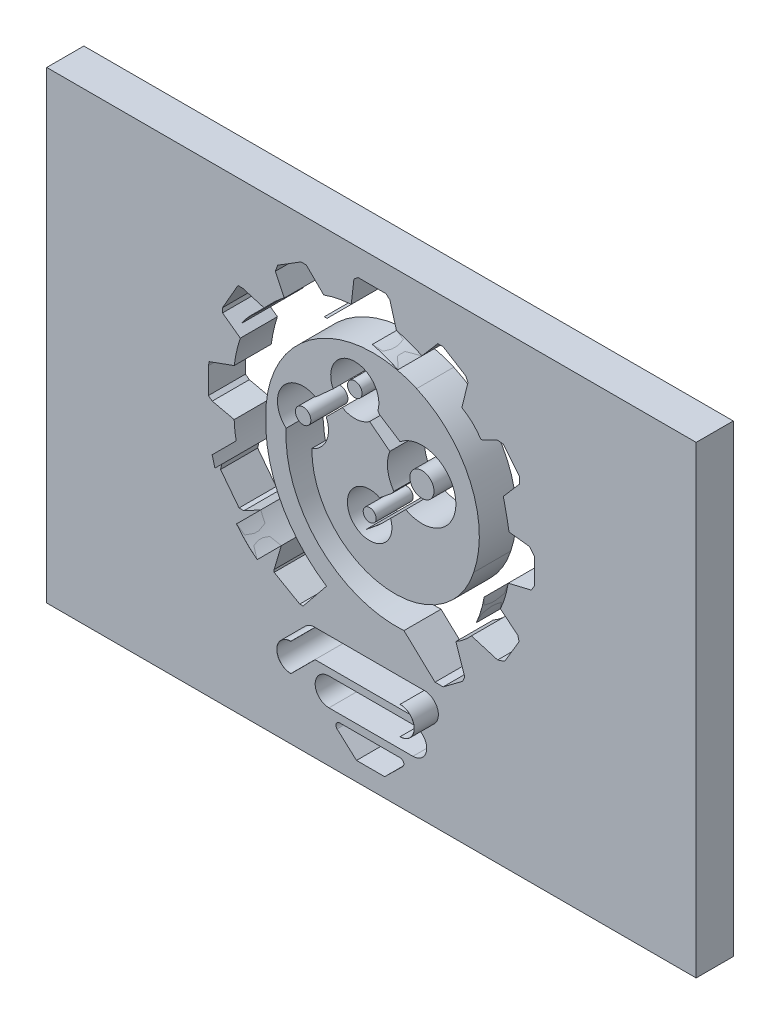
from build123d import *

# Parameters (mm, degrees)
BOSS_EXTRUDE1_DEPTH   = 10
BOSS_EXTRUDE1_2_DEPTH = 10
BOSS_EXTRUDE1_3_DEPTH = 10
SKETCH1_R             = 1.735714146
SKETCH1_R_2           = 3.25388296
SKETCH1_R_3           = 1.963199763
SKETCH1_R_4           = 2.077188844
BOSS_EXTRUDE1_4_DEPTH = 10
CUT_EXTRUDE2_DEPTH    = 3.5
SKETCH3_W             = 175
SKETCH3_H             = 125
BOSS_EXTRUDE2_DEPTH   = 10
CUT_EXTRUDE3_START    = -56
SKETCH4_R             = 2.077188844
SKETCH4_R_2           = 1.963199763
SKETCH4_R_3           = 3.25388296
SKETCH4_R_4           = 1.735714146
CUT_EXTRUDE3_DEPTH    = 56
SKETCH5_W             = 29.451232435
SKETCH5_H             = 6.5
CUT_EXTRUDE4_DEPTH    = 50


with BuildPart() as part:
    # Sketch1 → Boss-Extrude1 (new body)
    with BuildSketch(Plane.XY):
        with BuildLine():
            Line((36.612676513, 50.128115897), (66.063908948, 50.128115897))
            ThreePointArc((66.063908948, 50.128115897), (69.85606523, 46.335959615), (66.063908948, 42.543803333))
            Line((66.063908948, 42.543803333), (36.612676513, 42.543803333))
            ThreePointArc((36.612676513, 42.543803333), (32.82052023, 46.335959615), (36.612676513, 50.128115897))
        make_face()
    extrude(amount=BOSS_EXTRUDE1_DEPTH)



with BuildPart() as body_2:
    # Sketch1 → Boss-Extrude1 2 (new body)
    with BuildSketch(Plane.XY):
        with BuildLine():
            Line((40.371121954, 40.631857622), (62.992183574, 40.631857622))
            ThreePointArc((62.992183574, 40.631857622), (66.703998638, 36.920042558), (62.992183574, 33.208227494))
            Line((62.992183574, 33.208227494), (40.371121954, 33.208227494))
            ThreePointArc((40.371121954, 33.208227494), (36.65930689, 36.920042558), (40.371121954, 40.631857622))
        make_face()
    extrude(amount=BOSS_EXTRUDE1_2_DEPTH)


with BuildPart() as body_3:
    # Sketch1 → Boss-Extrude1 3 (new body)
    with BuildSketch(Plane.XY):
        with BuildLine():
            Line((43.291590681, 31.145459419), (59.548762461, 31.145459419))
            ThreePointArc((59.548762461, 31.145459419), (60.47915555, 30.526270831), (60.255275906, 29.431326214))
            Line((60.255275906, 29.431326214), (55.380256876, 24.642590707))
            Line((55.380256876, 24.642590707), (47.793576713, 24.642590707))
            Line((47.793576713, 24.642590707), (42.554783621, 29.366497269))
            ThreePointArc((42.554783621, 29.366497269), (42.328835394, 30.502145791), (43.291590681, 31.145459419))
        make_face()
    extrude(amount=BOSS_EXTRUDE1_3_DEPTH)


with BuildPart() as body_4:
    # Sketch1 → Boss-Extrude1 4 (new body)
    with BuildSketch(Plane.XY):
        with BuildLine():
            Line((54.042424699, 89.057178574), (57.338263311, 91.74525403))
            Line((57.338263311, 91.74525403), (57.858109934, 92.482001406))
            ThreePointArc((57.858109934, 92.482001406), (56.203750586, 96.735543385), (56.775287603, 101.263552843))
            Line((56.775287603, 101.263552843), (51.33821868, 105.502853511))
            ThreePointArc((51.33821868, 105.502853511), (47.717753365, 104.214223221), (43.975219744, 105.087022863))
            Line((43.975219744, 105.087022863), (39.619407743, 100.731210862))
            ThreePointArc((39.619407743, 100.731210862), (39.726080925, 95.257490785), (35.780591664, 91.461953256))
            ThreePointArc((35.780591664, 91.461953256), (54.470931261, 69.004961782), (79.367543752, 84.29561078))
            ThreePointArc((79.367543752, 84.29561078), (78.518157241, 104.885379157), (63.999024785, 119.509154728))
            ThreePointArc((63.999024785, 119.509154728), (36.348842887, 117.238880972), (23.350287639, 92.729204038))
            ThreePointArc((23.350287639, 92.729204038), (27.391085677, 74.838212259), (39.726172291, 61.263925027))
            Line((39.726172291, 61.263925027), (33.41222021, 53.484864806))
            Line((33.41222021, 53.484864806), (32.501801001, 53.484864806))
            Line((32.501801001, 53.484864806), (25.600419414, 57.431311375))
            Line((25.600419414, 57.431311375), (25.600419414, 58.091089656))
            Line((25.600419414, 58.091089656), (27.529461306, 64.624845993))
            add(Edge.make_bspline(
                [(27.529461306, 64.624845993), (24.51350433, 66.863878585), (21.96798092, 70.186326379)],
                knots=[0, 0, 0, 1, 1, 1], degree=2))
            Line((21.96798092, 70.186326379), (17.44826512, 67.73638598))
            Line((17.44826512, 67.73638598), (16.147653792, 67.73638598))
            Line((16.147653792, 67.73638598), (11.164001938, 74.227807572))
            Line((11.164001938, 74.227807572), (11.478280842, 75.608236048))
            Line((11.478280842, 75.608236048), (16.147653792, 80.277608998))
            add(Edge.make_bspline(
                [(14.836422664, 87.711108712), (14.969965726, 83.721585295), (16.147653792, 80.277608998)],
                knots=[0, 0, 0, 1, 1, 1], degree=2))
            Line((14.836422664, 87.711108712), (8.923989025, 89.057178574))
            Line((8.923989025, 89.057178574), (7.872310913, 89.823022551))
            Line((7.872310913, 89.823022551), (7.872310913, 96.783792065))
            Line((7.872310913, 96.783792065), (8.120139021, 97.872344214))
            Line((8.120139021, 97.872344214), (14.836422664, 100.309725684))
            ThreePointArc((14.836422664, 100.309725684), (15.482642582, 103.966872263), (16.483280209, 107.543329397))
            Line((16.483280209, 107.543329397), (11.70192116, 111.025169506))
            Line((11.70192116, 111.025169506), (11.70192116, 112.254374343))
            Line((11.70192116, 112.254374343), (15.850453276, 119.509154728))
            Line((15.850453276, 119.509154728), (17.116107143, 119.509154728))
            Line((17.116107143, 119.509154728), (23.350287639, 117.668560326))
            add(Edge.make_bspline(
                [(28.34341676, 122.838084344), (25.083188206, 120.541403415), (23.350287639, 117.668560326)],
                knots=[0, 0, 0, 1, 1, 1], degree=2))
            Line((28.34341676, 122.838084344), (25.924430047, 127.860583288))
            Line((25.924430047, 127.860583288), (26.55905403, 129.601522707))
            Line((26.55905403, 129.601522707), (32.835382419, 133.499504209))
            Line((32.835382419, 133.499504209), (34.268559767, 133.499504209))
            Line((34.268559767, 133.499504209), (38.960915607, 128.841575946))
            add(Edge.make_bspline(
                [(46.383652832, 130.361469468), (43.207748731, 130.193389879), (38.960915607, 128.841575946)],
                knots=[0, 0, 0, 1, 1, 1], degree=2))
            Line((46.383652832, 130.361469468), (47.099801145, 136.637538949))
            Line((47.099801145, 136.637538949), (48.204973985, 137.54371488))
            Line((48.204973985, 137.54371488), (55.716804255, 137.54371488))
            Line((55.716804255, 137.54371488), (56.775287603, 136.637538949))
            Line((56.775287603, 136.637538949), (58.560830407, 130.361469468))
            add(Edge.make_bspline(
                [(65.42141471, 127.860583288), (62.762273281, 129.346820645), (58.560830407, 130.361469468)],
                knots=[0, 0, 0, 1, 1, 1], degree=2))
            Line((65.42141471, 127.860583288), (69.703471426, 132.862355649))
            Line((69.703471426, 132.862355649), (71.141353612, 132.862355649))
            Line((71.141353612, 132.862355649), (77.253367018, 129.076282377))
            Line((77.253367018, 129.076282377), (77.838884302, 127.860583288))
            Line((77.838884302, 127.860583288), (76.183025885, 121.169766859))
            add(Edge.make_bspline(
                [(76.183025885, 121.169766859), (79.253811261, 119.413315061), (81.326289538, 116.311143396)],
                knots=[0, 0, 0, 1, 1, 1], degree=2))
            Line((81.326289538, 116.311143396), (81.695672628, 116.410742944))
            Line((81.695672628, 116.410742944), (85.815355288, 118.394906151))
            Line((85.815355288, 118.394906151), (87.360330483, 118.218612472))
            Line((87.360330483, 118.218612472), (91.659132082, 112.975790841))
            Line((91.659132082, 112.975790841), (91.659132082, 111.025169506))
            Line((91.659132082, 111.025169506), (87.360330483, 106.045624317))
            Line((87.360330483, 106.045624317), (88.905274365, 98.500548104))
            Line((88.905274365, 98.500548104), (94.4129898, 97.87207496))
            Line((94.4129898, 97.87207496), (95.767055319, 96.21186062))
            Line((95.767055319, 96.21186062), (95.767055319, 89.382694603))
            Line((95.767055319, 89.382694603), (94.909859849, 87.946746758))
            Line((94.909859849, 87.946746758), (88.683296287, 86.458456895))
            add(Edge.make_bspline(
                [(88.683296287, 86.458456895), (88.100618882, 82.748375774), (86.564981896, 79.397644229)],
                knots=[0, 0, 0, 1, 1, 1], degree=2))
            Line((86.564981896, 79.397644229), (91.245566834, 75.624301928))
            Line((91.245566834, 75.624301928), (91.598019479, 74.227807572))
            Line((91.598019479, 74.227807572), (87.722936412, 67.73638598))
            Line((87.722936412, 67.73638598), (85.815355288, 67.093511057))
            Line((85.815355288, 67.093511057), (78.775745724, 69.205464306))
            add(Edge.make_bspline(
                [(78.775745724, 69.205464306), (76.888993362, 67.188035301), (74.572909919, 65.777644834)],
                knots=[0, 0, 0, 1, 1, 1], degree=2))
            Line((74.572909919, 65.777644834), (76.954362748, 58.711239992))
            Line((76.954362748, 58.711239992), (76.421059157, 57.431311375))
            Line((76.421059157, 57.431311375), (71.141353612, 53.484864806))
            Line((71.141353612, 53.484864806), (68.954808891, 53.484864806))
            Line((68.954808891, 53.484864806), (60.578889007, 61.332051704))
            ThreePointArc((60.578889007, 61.332051704), (37.638360698, 69.85475845), (28.834470871, 92.688853424))
            ThreePointArc((28.834470871, 92.688853424), (27.758447656, 101.854708046), (36.751263907, 103.928345615))
            Line((36.751263907, 103.928345615), (41.493079417, 108.204751423))
            ThreePointArc((41.493079417, 108.204751423), (46.823385651, 117.490522776), (53.542937831, 109.154736511))
            Line((53.542937831, 109.154736511), (54.042232948, 108.423261616))
            Line((54.042232948, 108.423261616), (59.548581239, 104.89051106))
            ThreePointArc((59.548581239, 104.89051106), (74.526662809, 98.789825799), (61.067178135, 89.823022551))
            Line((61.067178135, 89.823022551), (60.090678716, 88.942366655))
            Line((60.090678716, 88.942366655), (56.775372182, 86.238413225))
            ThreePointArc((56.775372182, 86.238413225), (47.03062353, 79.524599219), (54.042424699, 89.057178574))
        make_face()
        with Locations((51.33830326, 83.70113079)):
            Circle(SKETCH1_R, mode=Mode.SUBTRACT)
        with Locations((65.42141471, 97.872141243)):
            Circle(SKETCH1_R_2, mode=Mode.SUBTRACT)
        with Locations((47.333100287, 111.025169506)):
            Circle(SKETCH1_R_3, mode=Mode.SUBTRACT)
        with Locations((33.41222021, 97.872344214)):
            Circle(SKETCH1_R_4, mode=Mode.SUBTRACT)
    extrude(amount=BOSS_EXTRUDE1_4_DEPTH)

    # Sketch2 → Cut-Extrude2 (cut)
    with BuildSketch(Plane(origin=(0, 0, 0), x_dir=(-1, 0, 0), z_dir=(0, 0, -1))):
        with BuildLine():
            Line((-36.882576832, 101.353568923), (-42.290231098, 106.230461342))
            Line((-42.290231098, 106.230461342), (-37.080357203, 101.020587447))
            ThreePointArc((-37.080357203, 101.020587447), (-37.893710893, 96.06046516), (-33.861615538, 93.059371298))
            ThreePointArc((-33.861615538, 93.059371298), (-53.367472026, 67.172595862), (-81.267551741, 83.670751264))
            ThreePointArc((-81.267551741, 83.670751264), (-80.346652287, 105.695765365), (-64.812170652, 121.336391385))
            ThreePointArc((-64.812170652, 121.336391385), (-35.268906863, 118.922417224), (-21.349861224, 92.751978269))
            ThreePointArc((-21.349861224, 92.751978269), (-25.129717063, 74.884715442), (-36.81226348, 60.847461425))
            Line((-36.81226348, 60.847461425), (-32.641490793, 55.708890291))
            Line((-32.641490793, 55.708890291), (-27.799852639, 58.477504958))
            Line((-27.799852639, 58.477504958), (-29.856074316, 65.442025158))
            add(Edge.make_bspline(
                [(-29.856074316, 65.442025158), (-29.175521421, 65.883970458), (-27.879064513, 66.83183634), (-26.00235788, 68.531221621), (-24.519885547, 70.169582429), (-23.383769421, 71.61199016), (-22.824457002, 72.38961669), (-22.555784216, 72.779877494)],
                knots=[0.500282491, 0.500282491, 0.500282491, 0.500282491, 0.500474616, 0.500666741, 0.500858866, 0.500954928, 0.501050991, 0.501050991, 0.501050991, 0.501050991], degree=3))
            Line((-22.555784216, 72.779877494), (-17.0770441, 69.810091883))
            Line((-17.0770441, 69.810091883), (-13.355732604, 74.657260685))
            Line((-13.355732604, 74.657260685), (-18.472416218, 79.773944264))
            add(Edge.make_bspline(
                [(-18.472416218, 79.773944264), (-18.180879786, 80.48416116), (-17.682088455, 81.925076377), (-17.152529334, 84.237432109), (-16.903073855, 86.281021736), (-16.819114201, 87.983569854), (-16.816446117, 88.87065466), (-16.824762225, 89.309605882)],
                knots=[0.500152836, 0.500152836, 0.500152836, 0.500152836, 0.500341207, 0.500529579, 0.500717951, 0.500812137, 0.500906323, 0.500906323, 0.500906323, 0.500906323], degree=3))
            Line((-16.824762225, 89.309605882), (-9.872310913, 90.892454127))
            Line((-9.872310913, 90.892454127), (-9.872310913, 96.380589694))
            Line((-9.872310913, 96.380589694), (-16.688696078, 98.854298633))
            ThreePointArc((-16.688696078, 98.854298633), (-17.459873001, 103.641146011), (-18.868263889, 108.280656412))
            Line((-18.868263889, 108.280656412), (-13.83108217, 111.948789503))
            Line((-13.83108217, 111.948789503), (-16.984161581, 117.462763608))
            Line((-16.984161581, 117.462763608), (-24.362840661, 115.284264699))
            add(Edge.make_bspline(
                [(-24.362840661, 115.284264699), (-24.646652824, 115.933709084), (-25.322213081, 117.159331227), (-26.734958109, 118.921539462), (-28.263474131, 120.307897606), (-29.694417524, 121.359457035), (-30.504172759, 121.879036013), (-30.908098275, 122.122180546)],
                knots=[0.500066259, 0.500066259, 0.500066259, 0.500066259, 0.50030451, 0.500542761, 0.500781012, 0.500900138, 0.501019263, 0.501019263, 0.501019263, 0.501019263], degree=3))
            Line((-30.908098275, 122.122180546), (-28.092433001, 127.968296092))
            Line((-28.092433001, 127.968296092), (-28.20138546, 128.267181157))
            Line((-28.20138546, 128.267181157), (-33.405905009, 131.499504209))
            Line((-33.405905009, 131.499504209), (-33.444443051, 131.499504209))
            Line((-33.444443051, 131.499504209), (-38.424034638, 126.556447474))
            add(Edge.make_bspline(
                [(-38.424034638, 126.556447474), (-38.923711949, 126.728684385), (-39.951259542, 127.065423843), (-41.843524077, 127.61415179), (-44.028521179, 128.110611382), (-45.919655934, 128.349957825), (-47.272276607, 128.396300717), (-47.862527424, 128.375584423), (-48.167409158, 128.352648043)],
                knots=[0.498388849, 0.498388849, 0.498388849, 0.498388849, 0.498504097, 0.498619345, 0.498849841, 0.499080336, 0.499195584, 0.499310832, 0.499310832, 0.499310832, 0.499310832], degree=3))
            Line((-48.167409158, 128.352648043), (-48.98796579, 135.54371488))
            Line((-48.98796579, 135.54371488), (-54.977634657, 135.54371488))
            Line((-54.977634657, 135.54371488), (-55.016607432, 135.51034998))
            Line((-55.016607432, 135.51034998), (-56.961233789, 128.675111375))
            add(Edge.make_bspline(
                [(-56.961233789, 128.675111375), (-57.464027583, 128.566846208), (-58.490262419, 128.328466938), (-60.333224179, 127.828546009), (-62.377183896, 127.133223702), (-64.025150243, 126.370532014), (-65.124626428, 125.721214295), (-65.576552985, 125.405761049), (-65.803735329, 125.231839517)],
                knots=[0.498448059, 0.498448059, 0.498448059, 0.498448059, 0.498564687, 0.498681315, 0.498914572, 0.499147829, 0.499264457, 0.499381086, 0.499381086, 0.499381086, 0.499381086], degree=3))
            Line((-65.803735329, 125.231839517), (-70.606053504, 130.841317314))
            Line((-70.606053504, 130.841317314), (-75.704481358, 127.683107385))
            Line((-75.704481358, 127.683107385), (-75.724393252, 127.641764675))
            Line((-75.724393252, 127.641764675), (-73.857837803, 120.099586634))
            add(Edge.make_bspline(
                [(-73.857837803, 120.099586634), (-74.541582528, 119.803442256), (-75.874683158, 119.090225533), (-77.595265055, 117.741920573), (-78.864618446, 116.344789805), (-79.772400534, 115.062979337), (-80.200086859, 114.348519017), (-80.397886573, 113.989382219)],
                knots=[0.499682977, 0.499682977, 0.499682977, 0.499682977, 0.499917437, 0.500151898, 0.500386359, 0.50050359, 0.50062082, 0.50062082, 0.50062082, 0.50062082], degree=3))
            Line((-80.397886573, 113.989382219), (-82.395941522, 114.528132845))
            Line((-82.395941522, 114.528132845), (-86.162659389, 116.34229758))
            Line((-86.162659389, 116.34229758), (-86.327907229, 116.323441517))
            Line((-86.327907229, 116.323441517), (-89.659132082, 112.260677206))
            Line((-89.659132082, 112.260677206), (-89.659132082, 111.76903796))
            Line((-89.659132082, 111.76903796), (-85.203674476, 106.608029253))
            Line((-85.203674476, 106.608029253), (-87.236979083, 96.67793509))
            Line((-87.236979083, 96.67793509), (-93.377553642, 95.977247801))
            Line((-93.377553642, 95.977247801), (-93.767055319, 95.499681347))
            Line((-93.767055319, 95.499681347), (-93.767055319, 89.934248869))
            Line((-93.767055319, 89.934248869), (-93.624785781, 89.695923256))
            Line((-93.624785781, 89.695923256), (-86.880583793, 88.083906073))
            add(Edge.make_bspline(
                [(-86.880583793, 88.083906073), (-86.793282577, 87.265096209), (-86.541207507, 85.621978009), (-85.946675868, 83.278937952), (-85.13382938, 81.017695887), (-84.440269594, 79.557543904), (-84.0602914, 78.847872764)],
                knots=[0.499526309, 0.499526309, 0.499526309, 0.499526309, 0.499704733, 0.499883157, 0.500061581, 0.500240005, 0.500240005, 0.500240005, 0.500240005], degree=3))
            Line((-84.0602914, 78.847872764), (-89.438495275, 74.512131731))
            Line((-89.438495275, 74.512131731), (-86.384253109, 69.395757914))
            Line((-86.384253109, 69.395757914), (-85.780104848, 69.192153589))
            Line((-85.780104848, 69.192153589), (-78.120866305, 71.490001727))
            add(Edge.make_bspline(
                [(-78.120866305, 71.490001727), (-77.70493696, 70.985012906), (-76.813481759, 70.007181831), (-75.383303928, 68.738229754), (-73.836976644, 67.634539742), (-72.716715394, 67.005220365), (-72.144124713, 66.722015581)],
                knots=[0.499572208, 0.499572208, 0.499572208, 0.499572208, 0.499740941, 0.499909675, 0.500078408, 0.500247141, 0.500247141, 0.500247141, 0.500247141], degree=3))
            Line((-72.144124713, 66.722015581), (-74.818735212, 58.785733908))
            Line((-74.818735212, 58.785733908), (-74.785364314, 58.705643751))
            Line((-74.785364314, 58.705643751), (-70.476484374, 55.484864806))
            Line((-70.476484374, 55.484864806), (-69.745318874, 55.484864806))
            Line((-69.745318874, 55.484864806), (-61.298146946, 63.398805937))
            ThreePointArc((-61.298146946, 63.398805937), (-38.969943576, 71.350920957), (-30.910982586, 93.64078293))
            ThreePointArc((-30.910982586, 93.64078293), (-29.525503748, 100.881619161), (-36.882576832, 101.353568923))
        make_face()
    extrude(amount=-CUT_EXTRUDE2_DEPTH, mode=Mode.SUBTRACT)


with BuildPart() as part_1:
    add(part.part)

    add(body_2.part)  # Boss-Extrude2 merges body 2

    add(body_3.part)  # Boss-Extrude2 merges body 3

    add(body_4.part)  # Boss-Extrude2 merges body 4
    # Sketch3 → Boss-Extrude2 (add)
    with BuildSketch(Plane(origin=(0, 0, 3.5), x_dir=(-1, 0, 0), z_dir=(0, 0, -1))):
        with Locations((-51.822055319, 82.130763027)):
            Rectangle(SKETCH3_W, SKETCH3_H)
    extrude(amount=BOSS_EXTRUDE2_DEPTH)

    # Sketch4 → Cut-Extrude3 (cut)
    # profile 1 of 4: a face of its own
    with BuildSketch(Plane.XY.offset(10).offset(CUT_EXTRUDE3_START)):
        with BuildLine():
            Line((95.767055319, 96.21186062), (95.767055319, 89.382694603))
            Line((95.767055319, 89.382694603), (94.909859849, 87.946746758))
            Line((94.909859849, 87.946746758), (88.683296287, 86.458456895))
            ThreePointArc((88.683296287, 86.458456895), (87.851237864, 82.85991866), (86.564981896, 79.397644229))
            Line((86.564981896, 79.397644229), (91.245566834, 75.624301928))
            Line((91.245566834, 75.624301928), (91.598019479, 74.227807572))
            Line((91.598019479, 74.227807572), (87.722936412, 67.73638598))
            Line((87.722936412, 67.73638598), (85.815355288, 67.093511057))
            Line((85.815355288, 67.093511057), (78.775745724, 69.205464306))
            ThreePointArc((78.775745724, 69.205464306), (76.813139121, 67.321358589), (74.572909919, 65.777644834))
            Line((74.572909919, 65.777644834), (76.954362748, 58.711239992))
            Line((76.954362748, 58.711239992), (76.421059157, 57.431311375))
            Line((76.421059157, 57.431311375), (71.141353612, 53.484864806))
            Line((71.141353612, 53.484864806), (68.954808891, 53.484864806))
            Line((68.954808891, 53.484864806), (60.578889007, 61.332051704))
            ThreePointArc((60.578889007, 61.332051704), (37.638360698, 69.85475845), (28.834470871, 92.688853424))
            ThreePointArc((28.834470871, 92.688853424), (27.758447656, 101.854708046), (36.751263907, 103.928345615))
            Line((36.751263907, 103.928345615), (41.493079417, 108.204751423))
            ThreePointArc((41.493079417, 108.204751423), (46.823385651, 117.490522776), (53.542937831, 109.154736511))
            Line((53.542937831, 109.154736511), (54.042232948, 108.423261616))
            Line((54.042232948, 108.423261616), (59.548581239, 104.89051106))
            ThreePointArc((59.548581239, 104.89051106), (74.526662809, 98.789825799), (61.067178135, 89.823022551))
            Line((61.067178135, 89.823022551), (56.775372182, 86.238413225))
            ThreePointArc((56.775372182, 86.238413225), (47.03062353, 79.524599219), (54.042424699, 89.057178574))
            Line((54.042424699, 89.057178574), (57.338263311, 91.74525403))
            Line((57.338263311, 91.74525403), (57.858109934, 92.482001406))
            ThreePointArc((57.858109934, 92.482001406), (56.203750586, 96.735543385), (56.775287603, 101.263552843))
            Line((56.775287603, 101.263552843), (51.33821868, 105.502853511))
            ThreePointArc((51.33821868, 105.502853511), (47.717753365, 104.214223221), (43.975219744, 105.087022863))
            Line((43.975219744, 105.087022863), (39.619407743, 100.731210862))
            ThreePointArc((39.619407743, 100.731210862), (39.726080925, 95.257490785), (35.780591664, 91.461953256))
            ThreePointArc((35.780591664, 91.461953256), (54.470931261, 69.004961782), (79.367543752, 84.29561078))
            ThreePointArc((79.367543752, 84.29561078), (78.518157241, 104.885379157), (63.999024785, 119.509154728))
            ThreePointArc((63.999024785, 119.509154728), (36.348842887, 117.238880972), (23.350287639, 92.729204038))
            ThreePointArc((23.350287639, 92.729204038), (27.391085677, 74.838212259), (39.726172291, 61.263925027))
            Line((39.726172291, 61.263925027), (33.41222021, 53.484864806))
            Line((33.41222021, 53.484864806), (32.501801001, 53.484864806))
            Line((32.501801001, 53.484864806), (25.600419414, 57.431311375))
            Line((25.600419414, 57.431311375), (25.600419414, 58.091089656))
            Line((25.600419414, 58.091089656), (27.529461306, 64.624845993))
            ThreePointArc((27.529461306, 64.624845993), (24.572591537, 67.229456611), (21.96798092, 70.186326379))
            Line((21.96798092, 70.186326379), (17.44826512, 67.73638598))
            Line((17.44826512, 67.73638598), (16.147653792, 67.73638598))
            Line((16.147653792, 67.73638598), (11.164001938, 74.227807572))
            Line((11.164001938, 74.227807572), (11.478280842, 75.608236048))
            Line((11.478280842, 75.608236048), (16.147653792, 80.277608998))
            ThreePointArc((16.147653792, 80.277608998), (15.212501807, 83.945050067), (14.836422664, 87.711108712))
            Line((14.836422664, 87.711108712), (8.923989025, 89.057178574))
            Line((8.923989025, 89.057178574), (7.872310913, 89.823022551))
            Line((7.872310913, 89.823022551), (7.872310913, 96.783792065))
            Line((7.872310913, 96.783792065), (8.120139021, 97.872344214))
            Line((8.120139021, 97.872344214), (14.836422664, 100.309725684))
            ThreePointArc((14.836422664, 100.309725684), (15.482642582, 103.966872263), (16.483280209, 107.543329397))
            Line((16.483280209, 107.543329397), (11.70192116, 111.025169506))
            Line((11.70192116, 111.025169506), (11.70192116, 112.254374343))
            Line((11.70192116, 112.254374343), (15.850453276, 119.509154728))
            Line((15.850453276, 119.509154728), (17.116107143, 119.509154728))
            Line((17.116107143, 119.509154728), (23.350287639, 117.668560326))
            ThreePointArc((23.350287639, 117.668560326), (25.595126092, 120.496459025), (28.34341676, 122.838084344))
            Line((28.34341676, 122.838084344), (25.924430047, 127.860583288))
            Line((25.924430047, 127.860583288), (26.55905403, 129.601522707))
            Line((26.55905403, 129.601522707), (32.835382419, 133.499504209))
            Line((32.835382419, 133.499504209), (34.268559767, 133.499504209))
            Line((34.268559767, 133.499504209), (38.960915607, 128.841575946))
            ThreePointArc((38.960915607, 128.841575946), (42.617932094, 129.866963371), (46.383652832, 130.361469468))
            Line((46.383652832, 130.361469468), (47.099801145, 136.637538949))
            Line((47.099801145, 136.637538949), (48.204973985, 137.54371488))
            Line((48.204973985, 137.54371488), (55.716804255, 137.54371488))
            Line((55.716804255, 137.54371488), (56.775287603, 136.637538949))
            Line((56.775287603, 136.637538949), (58.560830407, 130.361469468))
            ThreePointArc((58.560830407, 130.361469468), (62.061312636, 129.303576101), (65.42141471, 127.860583288))
            Line((65.42141471, 127.860583288), (69.703471426, 132.862355649))
            Line((69.703471426, 132.862355649), (71.141353612, 132.862355649))
            Line((71.141353612, 132.862355649), (77.253367018, 129.076282377))
            Line((77.253367018, 129.076282377), (77.838884302, 127.860583288))
            Line((77.838884302, 127.860583288), (76.183025885, 121.169766859))
            ThreePointArc((76.183025885, 121.169766859), (79.046866549, 119.049782883), (81.326289538, 116.311143396))
            Line((81.326289538, 116.311143396), (81.695672628, 116.410742944))
            Line((81.695672628, 116.410742944), (85.815355288, 118.394906151))
            Line((85.815355288, 118.394906151), (87.360330483, 118.218612472))
            Line((87.360330483, 118.218612472), (91.659132082, 112.975790841))
            Line((91.659132082, 112.975790841), (91.659132082, 111.025169506))
            Line((91.659132082, 111.025169506), (87.360330483, 106.045624317))
            ThreePointArc((87.360330483, 106.045624317), (88.18952067, 102.284699945), (88.905274365, 98.500548104))
            Line((88.905274365, 98.500548104), (94.4129898, 97.87207496))
            Line((94.4129898, 97.87207496), (95.767055319, 96.21186062))
        make_face()
        with Locations((33.41222021, 97.872344214)):
            Circle(SKETCH4_R, mode=Mode.SUBTRACT)
        with Locations((47.333100287, 111.025169506)):
            Circle(SKETCH4_R_2, mode=Mode.SUBTRACT)
        with Locations((65.42141471, 97.872141243)):
            Circle(SKETCH4_R_3, mode=Mode.SUBTRACT)
        with Locations((51.33830326, 83.70113079)):
            Circle(SKETCH4_R_4, mode=Mode.SUBTRACT)
    # profile 2 of 4: a face of its own
    with BuildSketch(Plane.XY.offset(10).offset(CUT_EXTRUDE3_START)):
        with BuildLine():
            Line((55.380256876, 24.642590707), (47.793576713, 24.642590707))
            Line((47.793576713, 24.642590707), (42.554783621, 29.366497269))
            ThreePointArc((42.554783621, 29.366497269), (42.328835394, 30.502145791), (43.291590681, 31.145459419))
            Line((43.291590681, 31.145459419), (59.548762461, 31.145459419))
            ThreePointArc((59.548762461, 31.145459419), (60.475775661, 30.524877743), (60.255275906, 29.431326214))
            Line((60.255275906, 29.431326214), (55.380256876, 24.642590707))
        make_face()
    # profile 3 of 4: a face of its own
    with BuildSketch(Plane.XY.offset(10).offset(CUT_EXTRUDE3_START)):
        with BuildLine():
            Line((66.063908948, 42.575563047), (36.612676513, 42.575563047))
            ThreePointArc((36.612676513, 42.575563047), (32.852795459, 46.3354441), (36.612676513, 50.095325154))
            Line((36.612676513, 50.095325154), (66.063908948, 50.095325154))
            ThreePointArc((66.063908948, 50.095325154), (69.823790002, 46.3354441), (66.063908948, 42.575563047))
        make_face()
    # profile 4 of 4: a face of its own
    with BuildSketch(Plane.XY.offset(10).offset(CUT_EXTRUDE3_START)):
        with BuildLine():
            Line((62.992183574, 33.204893743), (40.371121954, 33.204893743))
            ThreePointArc((40.371121954, 33.204893743), (36.65597314, 36.920042558), (40.371121954, 40.635191373))
            Line((40.371121954, 40.635191373), (62.992183574, 40.635191373))
            ThreePointArc((62.992183574, 40.635191373), (66.707332388, 36.920042558), (62.992183574, 33.204893743))
        make_face()
    extrude(amount=CUT_EXTRUDE3_DEPTH, mode=Mode.SUBTRACT)


with BuildPart() as cut_extrude3_piece_1:
    # of the separate pieces the step leaves, piece 1, a body of its own (cut_extrude3_pieces)
    add(part_1.part.solids().sort_by_distance((66.063908948, 50.128115897, 3.5))[0])

    # Sketch5 → Cut-Extrude4 (cut)
    with BuildSketch(Plane(origin=(0, 50.128115897, 0), x_dir=(1, 0, 0), z_dir=(0, 1, 0))):
        with Locations((51.338292731, -6.75)):
            Rectangle(SKETCH5_W, SKETCH5_H)
    extrude(amount=-CUT_EXTRUDE4_DEPTH, mode=Mode.SUBTRACT)


with BuildPart() as cut_extrude3_piece_2:
    # of the separate pieces the step leaves, piece 2, a body of its own (cut_extrude3_pieces)
    add(part_1.part.solids().sort_by_distance((68.67529767, 97.872141243, -6.5))[0])


with BuildPart() as cut_extrude3_piece_3:
    # of the separate pieces the step leaves, piece 3, a body of its own (cut_extrude3_pieces)
    add(part_1.part.solids().sort_by_distance((35.489409053, 97.872344214, -6.5))[0])


with BuildPart() as cut_extrude3_piece_4:
    # of the separate pieces the step leaves, piece 4, a body of its own (cut_extrude3_pieces)
    add(part_1.part.solids().sort_by_distance((49.29630005, 111.025169506, -6.5))[0])


with BuildPart() as cut_extrude3_piece_5:
    # of the separate pieces the step leaves, piece 5, a body of its own (cut_extrude3_pieces)
    add(part_1.part.solids().sort_by_distance((53.074017406, 83.70113079, -6.5))[0])


solid = Compound([cut_extrude3_piece_1.part, cut_extrude3_piece_2.part, cut_extrude3_piece_3.part, cut_extrude3_piece_4.part, cut_extrude3_piece_5.part])
